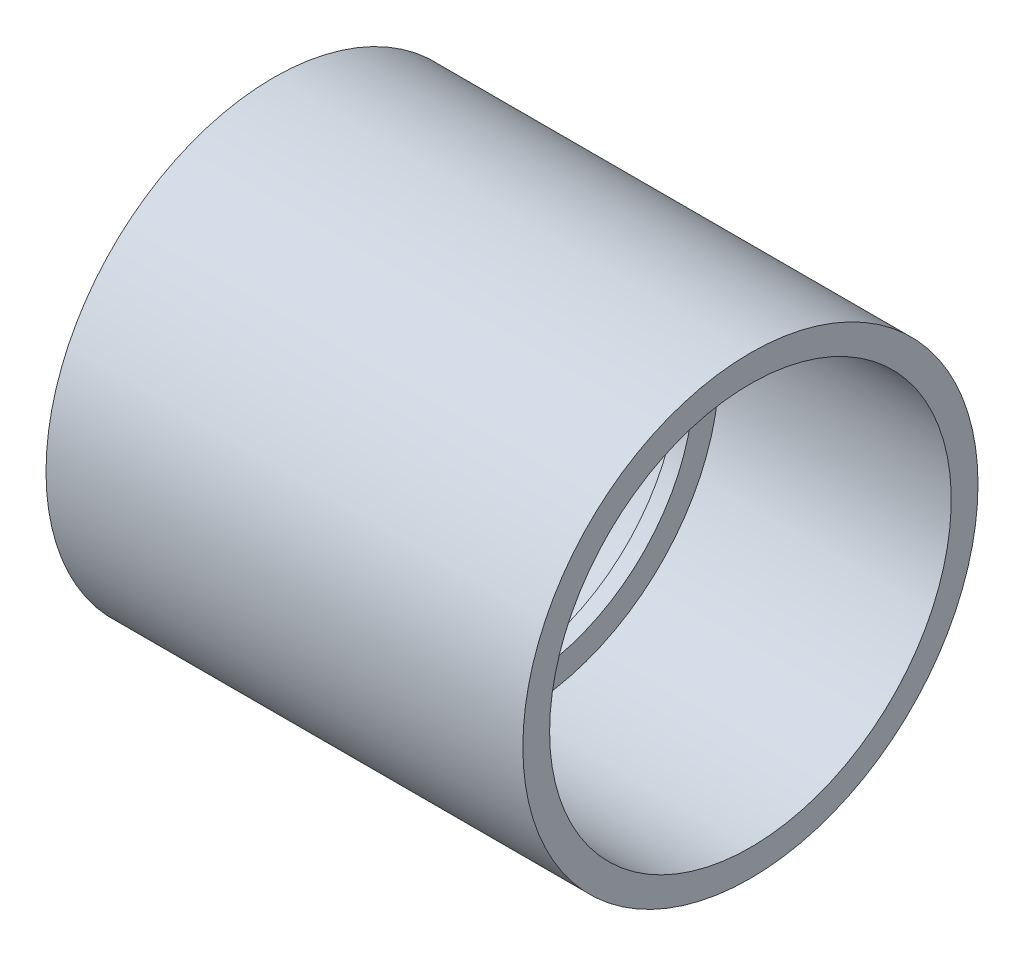
from build123d import *


with BuildPart() as part:
    # Sketch1 → Revolve1 (revolve)
    with BuildSketch(Plane.XY, mode=Mode.PRIVATE) as revolve1_sk:
        Polygon((-1.1938, -26.2509), (1.1938, -26.2509), (1.1938, -30.0863), (35.9918, -30.3149), (35.9918, -34.3535), (-35.9918, -34.3535), (-35.9918, -30.3149), (-1.1938, -30.0863), align=None)
    revolve(revolve1_sk.sketch.rotate(Axis((-35.9918, 0, 0), (1, 0, 0)), 270), axis=Axis((-35.9918, 0, 0), (1, 0, 0)))


solid = part.part
